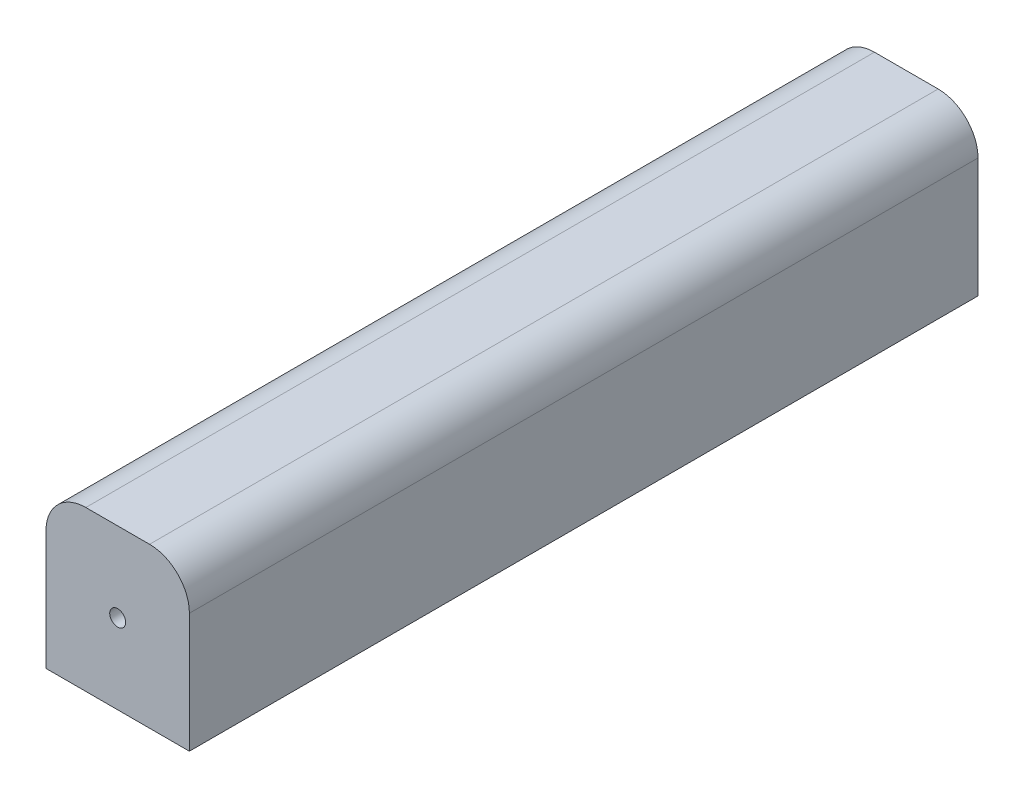
from build123d import *

# Parameters (mm, degrees)
EXTRUDE_1_DEPTH     = 99
SKETCH_2_R          = 1
CUT_EXTRUDE_1_DEPTH = 5
CUT_EXTRUDE_START   = -5
SKETCH_3_R          = 1
CUT_EXTRUDE_2_DEPTH = 5


with BuildPart() as part:
    # 草图1 → 凸台-拉伸1 (new body)
    with BuildSketch(Plane.XY):
        with BuildLine():
            Line((-4, 10), (4, 10))
            ThreePointArc((4, 10), (7.535533906, 8.535533906), (9, 5))
            Line((9, 5), (9, -10))
            Line((9, -10), (-9, -10))
            Line((-9, -10), (-9, 5))
            ThreePointArc((-9, 5), (-7.535533906, 8.535533906), (-4, 10))
        make_face()
    extrude(amount=EXTRUDE_1_DEPTH)

    # 草图2 → 切除-拉伸1 (cut)
    with BuildSketch(Plane.XY.offset(99)):
        Circle(SKETCH_2_R)
    extrude(amount=-CUT_EXTRUDE_1_DEPTH, mode=Mode.SUBTRACT)

    # 草图3 → 切除-拉伸2 (cut)
    with BuildSketch(Plane(origin=(0, 0, 0), x_dir=(-1, 0, 0), z_dir=(0, 0, -1)).offset(CUT_EXTRUDE_START)):
        with Locations(Location((0, 0, 0), (0, 0, 180))):
            Circle(SKETCH_3_R)
    extrude(amount=CUT_EXTRUDE_2_DEPTH, mode=Mode.SUBTRACT)


solid = part.part
